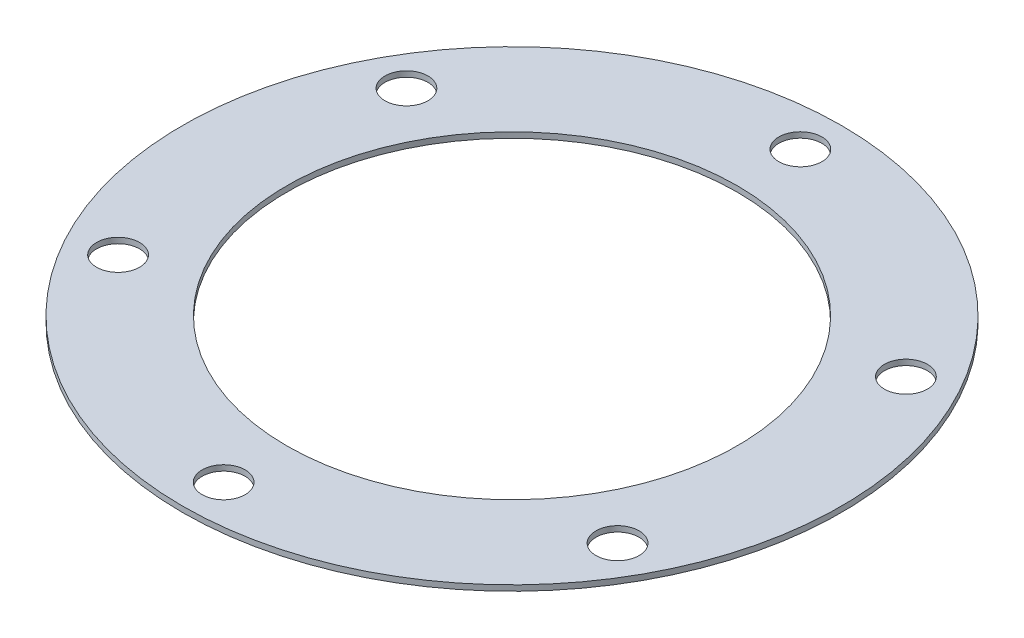
from build123d import *

# Parameters (mm, degrees)
SKETCH1_R           = 50.8
SKETCH1_R_2         = 3.3147
SKETCH1_R_3         = 34.7272
BOSS_EXTRUDE1_DEPTH = 0.8636


with BuildPart() as part:
    # Sketch1 → Boss-Extrude1 (new body)
    with BuildSketch(Plane(origin=(0, 0, 0), x_dir=(1, 0, 0), z_dir=(0, 1, 0))):
        with Locations(Location((0, 0, 0), (0, 0, 270))):
            Circle(SKETCH1_R)
        with Locations(Location((-38.494829198, 22.225, 0), (0, 0, 270))):
            Circle(SKETCH1_R_2, mode=Mode.SUBTRACT)
        with Locations(Location((-38.494829198, -22.225, 0), (0, 0, 270))):
            Circle(SKETCH1_R_2, mode=Mode.SUBTRACT)
        with Locations(Location((0, -44.45, 0), (0, 0, 270))):
            Circle(SKETCH1_R_2, mode=Mode.SUBTRACT)
        with Locations(Location((38.494829198, -22.225, 0), (0, 0, 270))):
            Circle(SKETCH1_R_2, mode=Mode.SUBTRACT)
        with Locations(Location((38.494829198, 22.225, 0), (0, 0, 270))):
            Circle(SKETCH1_R_2, mode=Mode.SUBTRACT)
        with Locations(Location((0, 44.45, 0), (0, 0, 270))):
            Circle(SKETCH1_R_2, mode=Mode.SUBTRACT)
        with Locations(Location((0, 0, 0), (0, 0, 270))):
            Circle(SKETCH1_R_3, mode=Mode.SUBTRACT)
    extrude(amount=BOSS_EXTRUDE1_DEPTH)


solid = part.part
